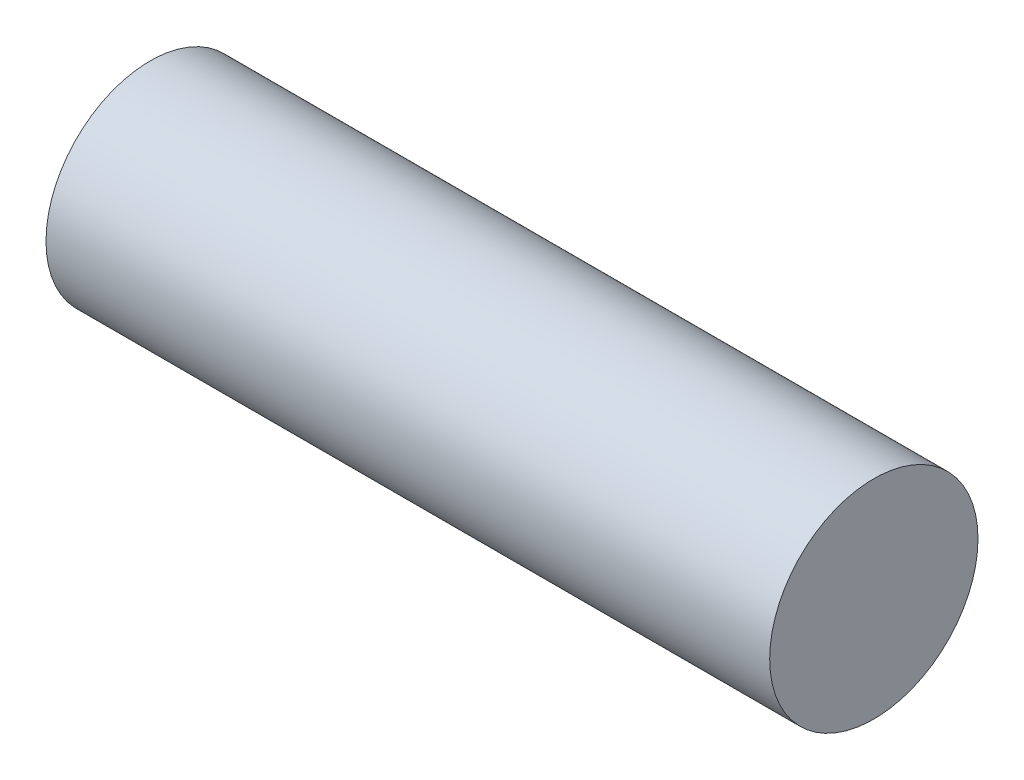
from build123d import *

# Parameters (mm, degrees)
SKETCH_2_R      = 9.5
EXTRUDE_1_DEPTH = 66


with BuildPart() as part:
    # 草图2 → 凸台-拉伸1 (new body)
    with BuildSketch(Plane(origin=(0, 0, 0), x_dir=(0, 0, -1), z_dir=(1, 0, 0))):
        Circle(SKETCH_2_R)
    extrude(amount=EXTRUDE_1_DEPTH)


solid = part.part
